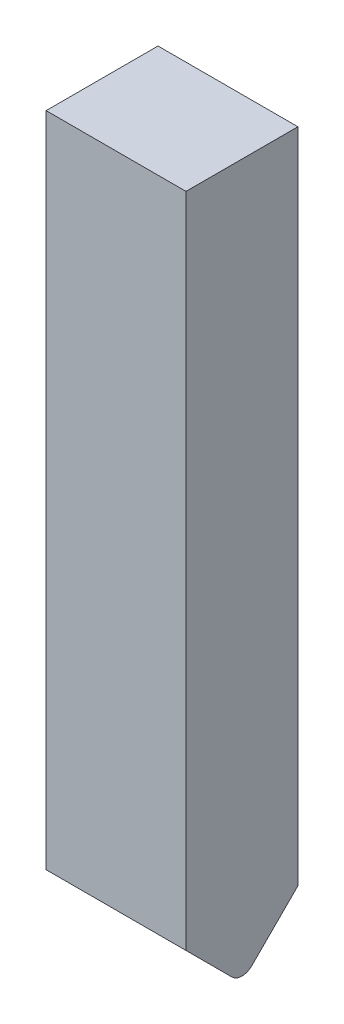
from build123d import *

# Parameters (mm, degrees)
BOSS_EXTRUDE1_DEPTH = 25.4
FILLET1_R           = 2.54


with BuildPart() as part:
    # Sketch1 → Boss-Extrude1 (new body)
    with BuildSketch(Plane(origin=(0, 0, 0), x_dir=(0, 0, -1), z_dir=(1, 0, 0))):
        Polygon((-10.16, 0), (-10.16, -119.38), (0, -129.54), (10.16, -119.38), (10.16, 0), align=None)
    extrude(amount=BOSS_EXTRUDE1_DEPTH)

    # Fillet1
    fillet1_edges = [part.edges().sort_by_distance(p)[0] for p in [
        (12.7, -129.54, 0),
    ]]
    fillet(fillet1_edges, radius=FILLET1_R)


solid = part.part
